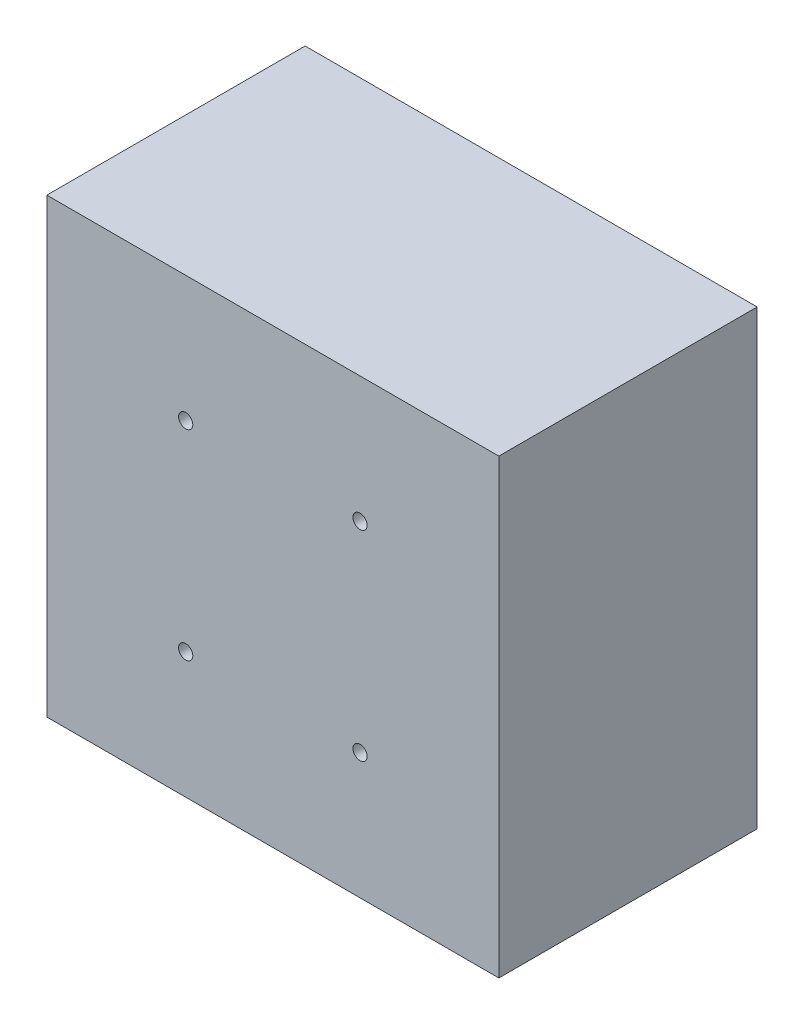
from build123d import *

# Parameters (mm, degrees)
SKETCH_1_W          = 70
SKETCH_1_H          = 70
EXTRUDE_1_DEPTH     = 40
SKETCH_2_R          = 1.1
CUT_EXTRUDE_1_DEPTH = 20


with BuildPart() as part:
    # 草图1 → 凸台-拉伸1 (new body)
    with BuildSketch(Plane.XY):
        with Locations((35, 35)):
            Rectangle(SKETCH_1_W, SKETCH_1_H)
    extrude(amount=EXTRUDE_1_DEPTH)

    # 草图2 → 切除-拉伸1 (cut)
    with BuildSketch(Plane.XY.offset(40)):
        with Locations((21.5, 50.5)):
            Circle(SKETCH_2_R)
        with Locations((48.5, 50.5)):
            Circle(SKETCH_2_R)
        with Locations((48.5, 19.5)):
            Circle(SKETCH_2_R)
        with Locations((21.5, 19.5)):
            Circle(SKETCH_2_R)
    extrude(amount=-CUT_EXTRUDE_1_DEPTH, mode=Mode.SUBTRACT)


solid = part.part
